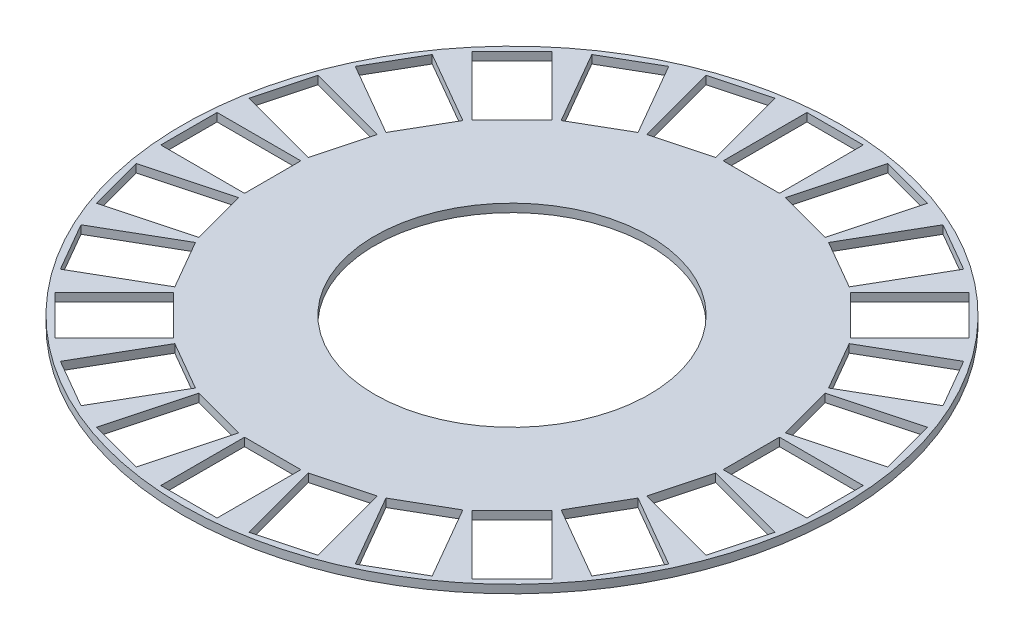
from build123d import *

# Parameters (mm, degrees)
SKETCH1_R           = 120
BOSS_EXTRUDE1_DEPTH = 1.5
SKETCH6_W           = 30.5
SKETCH6_H           = 20.5
SKETCH6_W_2         = 20.5
SKETCH6_H_2         = 30.5
CUT_EXTRUDE1_DEPTH  = 10.5


with BuildPart() as part:
    # Sketch1 → Boss-Extrude1 (new, symmetric)
    with BuildSketch(Plane(origin=(0, 0, 0), x_dir=(1, 0, 0), z_dir=(0, 1, 0))):
        with Locations(Location((98.638798209, 0, 0), (0, 0, 270))):
            Circle(SKETCH1_R)
        with BuildLine():
            ThreePointArc((118.472374081, -45.898031201), (49.529315887, -9.394612605), (100.131404816, 49.97771629))
            ThreePointArc((100.131404816, 49.97771629), (147.748280532, 9.394612605), (118.472374081, -45.898031201))
        make_face(mode=Mode.SUBTRACT)
    extrude(amount=BOSS_EXTRUDE1_DEPTH, both=True)

    # Sketch6 → Cut-Extrude1 (cut)
    with BuildSketch(Plane(origin=(0, 1.5, 0), x_dir=(1, 0, 0), z_dir=(0, 1, 0))):
        with Locations((-3.75, 0)):
            Rectangle(SKETCH6_W, SKETCH6_H)
        Polygon((-12.338659942, 40.347901139), (-17.644450367, 20.5464217), (11.816287335, 12.652440824), (17.122077759, 32.453920263), align=None)
        Polygon((1.885610489, 67.696159493), (-8.364389511, 49.942638716), (18.049385305, 34.692638716), (28.299385305, 52.446159493), align=None)
        Polygon((22.703450772, 90.431036452), (8.207761758, 75.935347437), (29.774518584, 54.368590611), (44.270207598, 68.864279625), align=None)
        Polygon((48.696159493, 107.00318772), (30.942638716, 96.75318772), (46.192638716, 70.339412904), (63.946159493, 80.589412904), align=None)
        Polygon((78.092376509, 116.283248576), (58.29089707, 110.977458152), (66.184877946, 81.51672045), (85.986357385, 86.822510874), align=None)
        with Locations((98.638798209, 102.388798209)):
            Rectangle(SKETCH6_W_2, SKETCH6_H_2)
        Polygon((138.986699348, 110.977458152), (119.185219909, 116.283248576), (111.291239034, 86.822510874), (131.092718473, 81.51672045), align=None)
        Polygon((166.334957703, 96.75318772), (148.581436925, 107.00318772), (133.331436925, 80.589412904), (151.084957703, 70.339412904), align=None)
        Polygon((189.069834661, 75.935347437), (174.574145646, 90.431036452), (153.00738882, 68.864279625), (167.503077834, 54.368590611), align=None)
        Polygon((205.641985929, 49.942638716), (195.391985929, 67.696159493), (168.978211114, 52.446159493), (179.228211114, 34.692638716), align=None)
        Polygon((214.922046785, 20.5464217), (209.616256361, 40.347901139), (180.155518659, 32.453920263), (185.461309084, 12.652440824), align=None)
        with Locations((201.027596418, 0)):
            Rectangle(SKETCH6_W, SKETCH6_H)
        Polygon((209.616256361, -40.347901139), (214.922046785, -20.5464217), (185.461309084, -12.652440824), (180.155518659, -32.453920263), align=None)
        Polygon((195.391985929, -67.696159493), (205.641985929, -49.942638716), (179.228211114, -34.692638716), (168.978211114, -52.446159493), align=None)
        Polygon((174.574145646, -90.431036451), (189.069834661, -75.935347437), (167.503077835, -54.368590611), (153.00738882, -68.864279625), align=None)
        Polygon((148.581436925, -107.00318772), (166.334957703, -96.75318772), (151.084957703, -70.339412904), (133.331436925, -80.589412904), align=None)
        Polygon((119.185219909, -116.283248576), (138.986699348, -110.977458152), (131.092718473, -81.51672045), (111.291239034, -86.822510874), align=None)
        with Locations((98.638798209, -102.388798209)):
            Rectangle(SKETCH6_W_2, SKETCH6_H_2)
        Polygon((58.29089707, -110.977458152), (78.092376509, -116.283248576), (85.986357385, -86.822510874), (66.184877946, -81.51672045), align=None)
        Polygon((30.942638716, -96.75318772), (48.696159493, -107.00318772), (63.946159493, -80.589412904), (46.192638716, -70.339412904), align=None)
        Polygon((8.207761758, -75.935347437), (22.703450772, -90.431036452), (44.270207598, -68.864279625), (29.774518584, -54.368590611), align=None)
        Polygon((-8.364389511, -49.942638716), (1.885610489, -67.696159493), (28.299385305, -52.446159493), (18.049385305, -34.692638716), align=None)
        Polygon((-17.644450367, -20.5464217), (-12.338659942, -40.347901139), (17.122077759, -32.453920263), (11.816287335, -12.652440824), align=None)
    extrude(amount=-CUT_EXTRUDE1_DEPTH, mode=Mode.SUBTRACT)


solid = part.part
